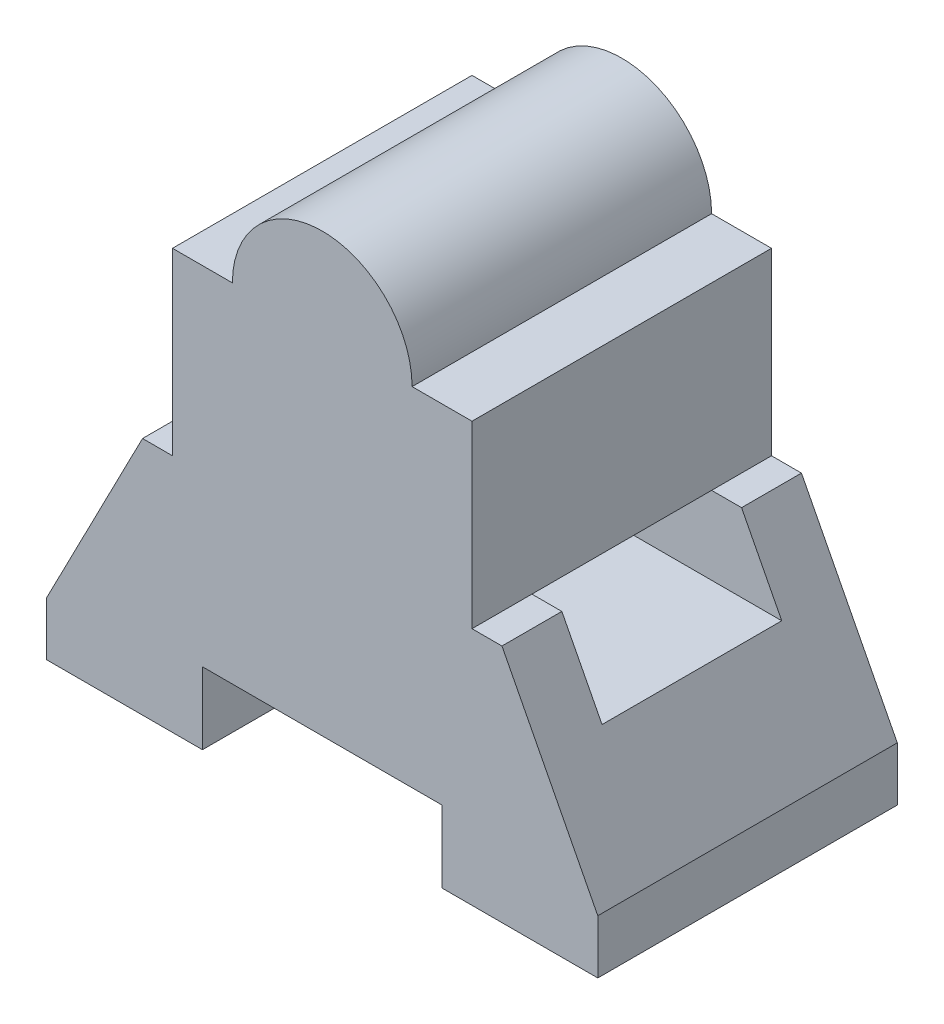
from build123d import *

# Parameters (mm, degrees)
BOSS_EXTRUDE1_DEPTH = 50
SKETCH5_W           = 30
SKETCH5_H           = 13
CUT_EXTRUDE1_DEPTH  = 135.866600758


with BuildPart() as part:
    # Sketch1 → Boss-Extrude1 (new body)
    with BuildSketch(Plane.XY):
        with BuildLine():
            Line((0, 0), (26, 0))
            Line((26, 0), (26, 12))
            Line((26, 12), (66, 12))
            Line((66, 12), (66, 0))
            Line((66, 0), (92, 0))
            Line((92, 0), (92, 9))
            Line((92, 9), (76, 40))
            Line((76, 40), (71, 40))
            Line((71, 40), (71, 70))
            Line((71, 70), (61, 70))
            ThreePointArc((61, 70), (46, 85), (31, 70))
            Line((31, 70), (21, 70))
            Line((21, 70), (21, 40))
            Line((21, 40), (16, 40))
            Line((16, 40), (0, 9))
            Line((0, 9), (0, 0))
        make_face()
    extrude(amount=BOSS_EXTRUDE1_DEPTH)

    # Sketch5 → Cut-Extrude1 (cut, through all)
    with BuildSketch(Plane(origin=(0, 0, 0), x_dir=(0, 0, -1), z_dir=(1, 0, 0))):
        with Locations((-25, 33.5)):
            Rectangle(SKETCH5_W, SKETCH5_H)
    extrude(amount=CUT_EXTRUDE1_DEPTH, mode=Mode.SUBTRACT)


solid = part.part
